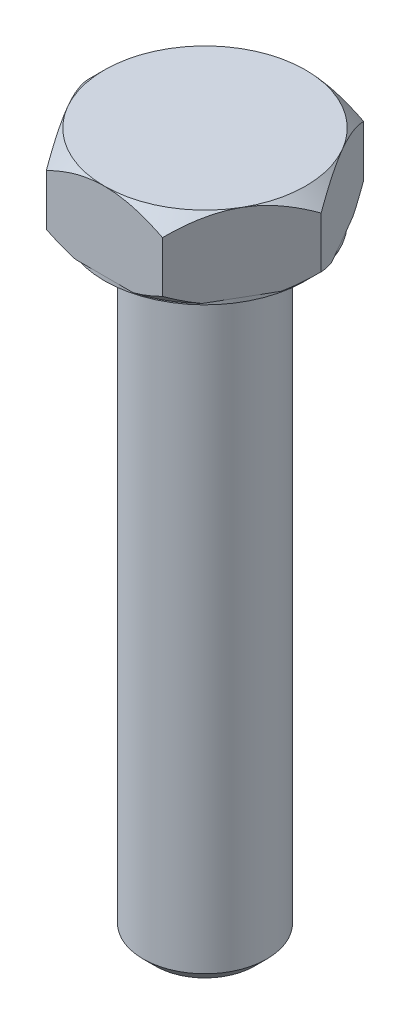
from build123d import *

# Parameters (mm, degrees)
BOSS_EXTRUDE1_DEPTH = 5.3
SKETCH2_OUTSIDE_W   = 21.122
SKETCH2_OUTSIDE_H   = 19.11
SKETCH2_OUTSIDE_R   = 6.5
CUT_EXTRUDE1_DEPTH  = 0.265
SKETCH3_R           = 4
BOSS_EXTRUDE2_DEPTH = 40
CHAMFER1_SIZE       = 0.8


with BuildPart() as part:
    # Sketch1 → Boss-Extrude1 (new body)
    with BuildSketch(Plane(origin=(0, 0, 0), x_dir=(1, 0, 0), z_dir=(0, 1, 0))):
        Polygon((7.505553499, 0), (3.75277675, 6.5), (-3.75277675, 6.5), (-7.505553499, 0), (-3.75277675, -6.5), (3.75277675, -6.5), align=None)
    extrude(amount=-BOSS_EXTRUDE1_DEPTH)

    # Sketch4 → Cut-Revolve1 (revolve, cut)
    with BuildSketch(Plane(origin=(0, 0, 0), x_dir=(0, 0, -1), z_dir=(1, 0, 0))):
        Polygon((-6.5, 0), (-8.15, 0), (-8.15, -1.65), align=None)
        Polygon((-8.15, -3.65), (-6.5, -5.3), (-8.15, -5.3), align=None)
    revolve(axis=Axis((0, 0, 0), (0, -1, 0)), mode=Mode.SUBTRACT)

    # Sketch2 outside → Cut-Extrude1 (cut)
    with BuildSketch(Plane.XZ.offset(5.3)):
        Rectangle(SKETCH2_OUTSIDE_W, SKETCH2_OUTSIDE_H)
        with Locations(Location((0, 0, 0), (0, 0, 90))):
            Circle(SKETCH2_OUTSIDE_R, mode=Mode.SUBTRACT)
    extrude(amount=-CUT_EXTRUDE1_DEPTH, mode=Mode.SUBTRACT)

    # Sketch3 → Boss-Extrude2 (add)
    with BuildSketch(Plane.XZ.offset(5.3)):
        with Locations(Location((0, 0, 0), (0, 0, 90))):
            Circle(SKETCH3_R)
    extrude(amount=BOSS_EXTRUDE2_DEPTH)

    # Chamfer1
    chamfer1_edges = [part.edges().sort_by_distance(p)[0] for p in [
        (0, -45.3, -4),
    ]]
    chamfer(chamfer1_edges, length=CHAMFER1_SIZE)


solid = part.part
